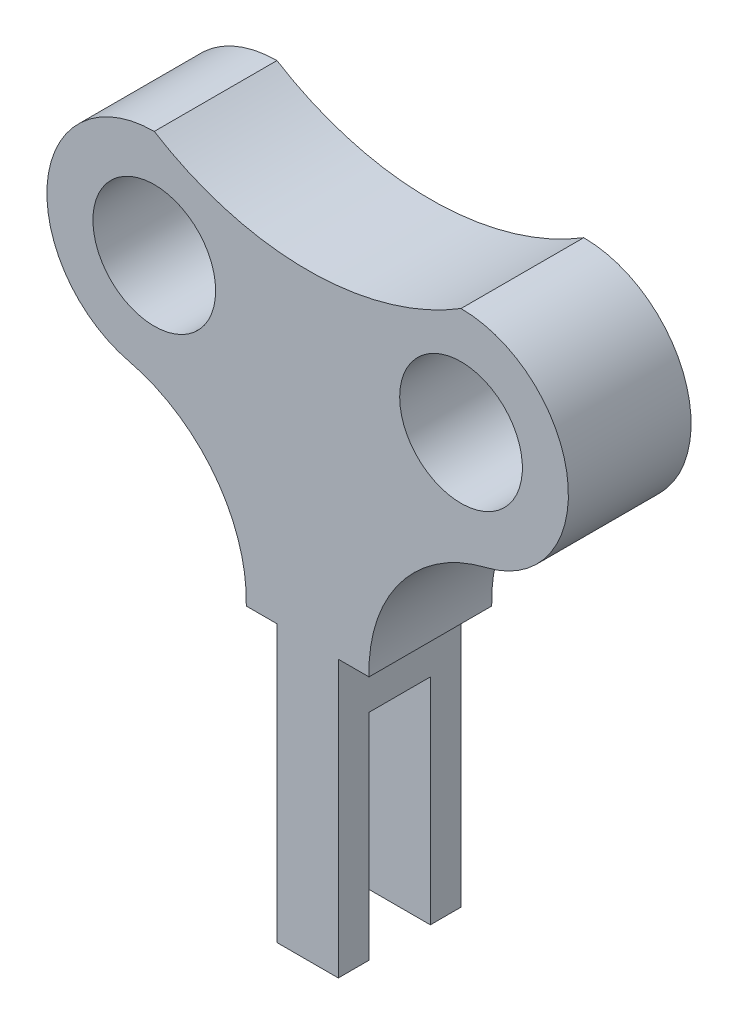
from build123d import *

# Parameters (mm, degrees)
SKETCH1_R           = 10
BOSS_EXTRUDE1_DEPTH = 20
SKETCH2_W           = 10
SKETCH2_H           = 35
CUT_EXTRUDE1_DEPTH  = 10


with BuildPart() as part:
    # Sketch1 → Boss-Extrude1 (new body)
    with BuildSketch(Plane.XY):
        with BuildLine():
            Line((5, -42), (10, -42))
            ThreePointArc((10, -42), (15.132819854, -26.12111797), (29.113715132, -17.009625152))
            ThreePointArc((29.113715132, -17.009625152), (42.376973847, 2.071419783), (25, 17.5))
            ThreePointArc((25, 17.5), (0, 10.405357444), (-25, 17.5))
            ThreePointArc((-25, 17.5), (-42.376973847, 2.071419783), (-29.113715132, -17.009625152))
            ThreePointArc((-29.113715132, -17.009625152), (-15.132819854, -26.12111797), (-10, -42))
            Line((-10, -42), (-5, -42))
            Line((-5, -42), (-5, -87))
            Line((-5, -87), (5, -87))
            Line((5, -87), (5, -42))
        make_face()
        with Locations((-25, 0)):
            Circle(SKETCH1_R, mode=Mode.SUBTRACT)
        with Locations(Location((25, 0, 0), (0, 0, 180))):
            Circle(SKETCH1_R, mode=Mode.SUBTRACT)
    extrude(amount=BOSS_EXTRUDE1_DEPTH)

    # Sketch2 → Cut-Extrude1 (cut)
    with BuildSketch(Plane(origin=(5, 0, 0), x_dir=(0, 0, -1), z_dir=(1, 0, 0))):
        with Locations((-10, -69.5)):
            Rectangle(SKETCH2_W, SKETCH2_H)
    extrude(amount=-CUT_EXTRUDE1_DEPTH, mode=Mode.SUBTRACT)


solid = part.part
